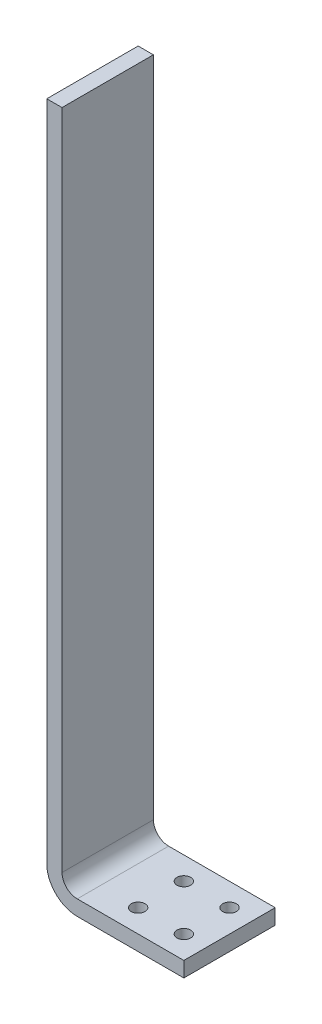
from build123d import *

# Parameters (mm, degrees)
BOSS_EXTRUDE1_DEPTH = 60
CUT_EXTRUDE1_REACH  = 459.957
SKETCH2_R           = 4.5


with BuildPart() as part:
    # Sketch1 → Boss-Extrude1 (new body)
    with BuildSketch(Plane.XY):
        with BuildLine():
            Line((0, 20), (0, 455))
            Line((0, 455), (10, 455))
            Line((10, 455), (10, 20))
            ThreePointArc((10, 20), (12.928932188, 12.928932188), (20, 10))
            Line((20, 10), (90, 10))
            Line((90, 10), (90, 0))
            Line((90, 0), (20, 0))
            ThreePointArc((20, 0), (5.857864376, 5.857864376), (0, 20))
        make_face()
    extrude(amount=BOSS_EXTRUDE1_DEPTH)

    # Sketch2 → Cut-Extrude1 (cut, up to next)
    with BuildSketch(Plane(origin=(0, 10, 0), x_dir=(1, 0, 0), z_dir=(0, 1, 0)), mode=Mode.PRIVATE) as cut_extrude1_sk1:
        with Locations(Location((75, -15, 0), (0, 0, 270))):
            Circle(SKETCH2_R)
    cut_extrude1_tool1 = extrude(cut_extrude1_sk1.sketch, amount=-CUT_EXTRUDE1_REACH, mode=Mode.PRIVATE) & part.part
    # Sketch2 → Cut-Extrude1 (cut, up to next)
    with BuildSketch(Plane(origin=(0, 10, 0), x_dir=(1, 0, 0), z_dir=(0, 1, 0)), mode=Mode.PRIVATE) as cut_extrude1_sk2:
        with Locations(Location((75, -45, 0), (0, 0, 270))):
            Circle(SKETCH2_R)
    cut_extrude1_tool2 = extrude(cut_extrude1_sk2.sketch, amount=-CUT_EXTRUDE1_REACH, mode=Mode.PRIVATE) & part.part
    # Sketch2 → Cut-Extrude1 (cut, up to next)
    with BuildSketch(Plane(origin=(0, 10, 0), x_dir=(1, 0, 0), z_dir=(0, 1, 0)), mode=Mode.PRIVATE) as cut_extrude1_sk3:
        with Locations(Location((45, -15, 0), (0, 0, 270))):
            Circle(SKETCH2_R)
    cut_extrude1_tool3 = extrude(cut_extrude1_sk3.sketch, amount=-CUT_EXTRUDE1_REACH, mode=Mode.PRIVATE) & part.part
    # Sketch2 → Cut-Extrude1 (cut, up to next)
    with BuildSketch(Plane(origin=(0, 10, 0), x_dir=(1, 0, 0), z_dir=(0, 1, 0)), mode=Mode.PRIVATE) as cut_extrude1_sk4:
        with Locations(Location((45, -45, 0), (0, 0, 270))):
            Circle(SKETCH2_R)
    cut_extrude1_tool4 = extrude(cut_extrude1_sk4.sketch, amount=-CUT_EXTRUDE1_REACH, mode=Mode.PRIVATE) & part.part
    add(cut_extrude1_tool1.solids().sort_by_distance((75, 10, 15))[0], mode=Mode.SUBTRACT)
    add(cut_extrude1_tool2.solids().sort_by_distance((75, 10, 45))[0], mode=Mode.SUBTRACT)
    add(cut_extrude1_tool3.solids().sort_by_distance((45, 10, 15))[0], mode=Mode.SUBTRACT)
    add(cut_extrude1_tool4.solids().sort_by_distance((45, 10, 45))[0], mode=Mode.SUBTRACT)


solid = part.part
